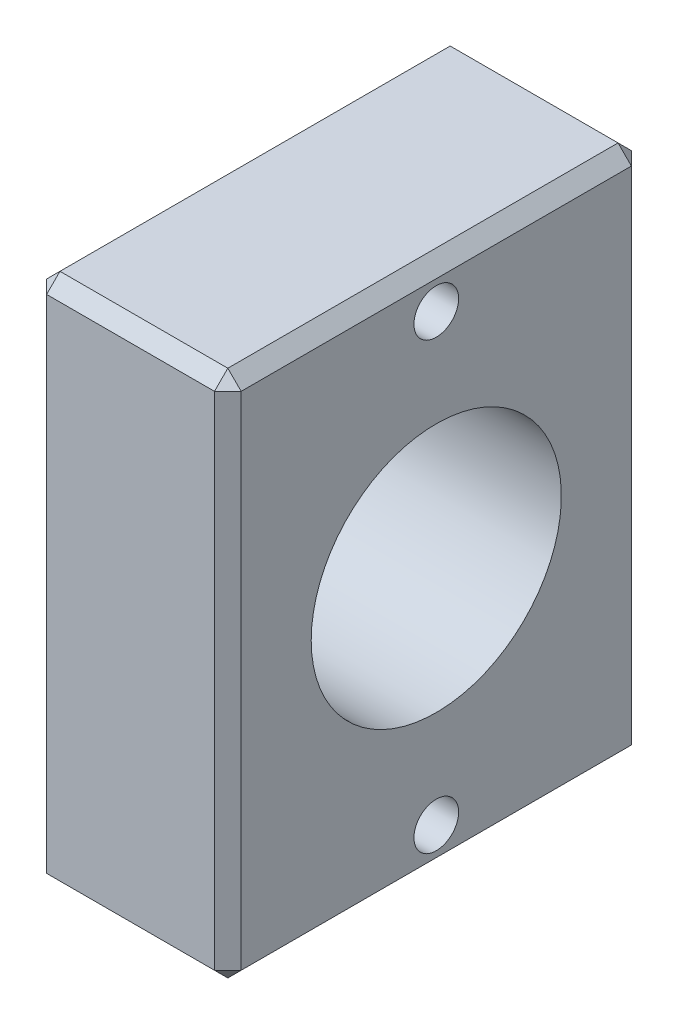
from build123d import *

# Parameters (mm, degrees)
SKETCH1_W           = 22.225
SKETCH1_H           = 47.625
BOSS_EXTRUDE1_DEPTH = 30.1625
SKETCH2_R           = 14.2875
SKETCH2_R_2         = 2.5527
CUT_EXTRUDE1_DEPTH  = 45.393267367
CHAMFER1_SIZE       = 1.524


with BuildPart() as part:
    # Sketch1 → Boss-Extrude1 (new, symmetric)
    with BuildSketch(Plane(origin=(0, 0, 0), x_dir=(1, 0, 0), z_dir=(0, 1, 0))):
        Rectangle(SKETCH1_W, SKETCH1_H)
    extrude(amount=BOSS_EXTRUDE1_DEPTH, both=True)

    # Sketch2 → Cut-Extrude1 (cut, through all)
    with BuildSketch(Plane.ZY.offset(11.1125)):
        Circle(SKETCH2_R)
        with Locations((0, 25.4)):
            Circle(SKETCH2_R_2)
        with Locations((0, -25.4)):
            Circle(SKETCH2_R_2)
    extrude(amount=-CUT_EXTRUDE1_DEPTH, mode=Mode.SUBTRACT)

    # Chamfer1
    chamfer1_edges = [part.edges().sort_by_distance(p)[0] for p in [
        (11.1125, 30.1625, 0),
        (0, 30.1625, -23.8125),
        (-11.1125, 30.1625, 0),
        (0, -30.1625, -23.8125),
        (11.1125, -30.1625, 0),
        (0, -30.1625, 23.8125),
        (-11.1125, -30.1625, 0),
        (-11.1125, 0, -23.8125),
        (11.1125, 0, -23.8125),
        (11.1125, 0, 23.8125),
        (-11.1125, 0, 23.8125),
        (0, 30.1625, 23.8125),
    ]]
    chamfer(chamfer1_edges, length=CHAMFER1_SIZE)


solid = part.part
